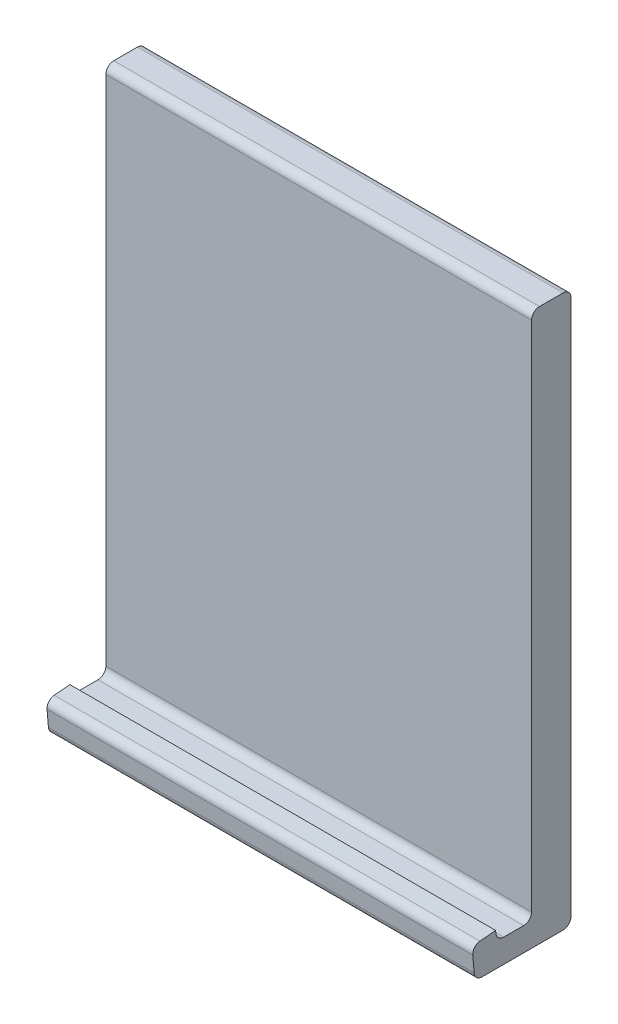
from build123d import *

# Parameters (mm, degrees)
SKETCH2_W           = 54
SKETCH2_H           = 70
BOSS_EXTRUDE1_DEPTH = 5
BOSS_EXTRUDE3_DEPTH = 54
FILLET1_R           = 1


with BuildPart() as part:
    # Sketch2 → Boss-Extrude1 (new body)
    with BuildSketch(Plane.XY):
        with Locations((27, 35)):
            Rectangle(SKETCH2_W, SKETCH2_H)
    extrude(amount=-BOSS_EXTRUDE1_DEPTH)

    # Sketch6 → Boss-Extrude3 (add, through all)
    with BuildSketch(Plane(origin=(0, 0, 0), x_dir=(0, 0, -1), z_dir=(1, 0, 0))):
        Polygon((5, 0), (5, 3), (-4.451006478, 3), (-4.560038877, 4.246246021), (-7.548622971, 3.984778792), (-7.2, 0), align=None)
    extrude(amount=BOSS_EXTRUDE3_DEPTH)

    # Fillet1
    fillet1_edges = [part.edges().sort_by_distance(p)[0] for p in [
        (27, 3, 0),
        (27, 70, -5),
        (27, 3, 4.451006478),
        (27, 3.984778792, 7.548622971),
        (27, 0, 7.2),
        (27, 70, 0),
        (27, 0, -5),
    ]]
    fillet(fillet1_edges, radius=FILLET1_R)


solid = part.part
